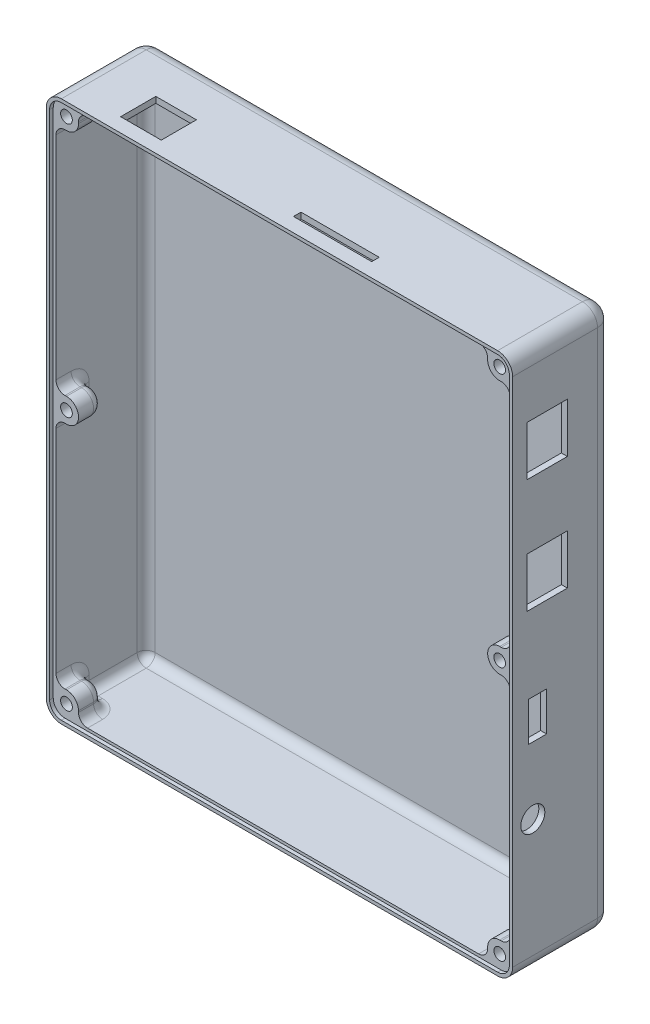
from build123d import *

# Parameters (mm, degrees)
SKETCH1_W           = 155
SKETCH1_H           = 180
BOSS_EXTRUDE1_DEPTH = 32
FILLET2_R           = 5
SHELL1_T            = -2
SKETCH2_R           = 1.95
BOSS_EXTRUDE2_DEPTH = 6
BOSS_EXTRUDE3_DEPTH = 2
FILLET1_R           = 3
BOSS_EXTRUDE4_START = 1.2
BOSS_EXTRUDE4_DEPTH = 1.2
SKETCH4_W           = 13.5
SKETCH4_H           = 11.7
CUT_EXTRUDE1_DEPTH  = 2
SKETCH5_W           = 26
SKETCH5_H           = 2.5
CUT_EXTRUDE2_DEPTH  = 2
SKETCH6_W           = 13.5
SKETCH6_H           = 16.5
CUT_EXTRUDE3_DEPTH  = 2
SKETCH7_W           = 6.1
SKETCH7_H           = 13
CUT_EXTRUDE4_DEPTH  = 2
SKETCH8_R           = 4
CUT_EXTRUDE5_DEPTH  = 2


with BuildPart() as part:
    # Sketch1 → Boss-Extrude1 (new body)
    with BuildSketch(Plane.XY):
        Rectangle(SKETCH1_W, SKETCH1_H)
    extrude(amount=BOSS_EXTRUDE1_DEPTH)

    # Fillet2
    fillet2_edges = [part.edges().sort_by_distance(p)[0] for p in [
        (0, -90, 0),
        (-77.5, 0, 0),
        (0, 90, 0),
        (77.5, 0, 0),
        (77.5, -90, 16),
        (-77.5, -90, 16),
        (-77.5, 90, 16),
        (77.5, 90, 16),
    ]]
    fillet(fillet2_edges, radius=FILLET2_R)

    # Shell1
    shell1_openings = [part.faces().sort_by_distance(p)[0] for p in [
        (0, 0, 32),
    ]]
    offset(amount=SHELL1_T, openings=shell1_openings, kind=Kind.INTERSECTION)

    # Sketch2 → Boss-Extrude2 (add)
    # profile 1 of 6: a face of its own
    with BuildSketch(Plane.XY.offset(32)):
        with BuildLine():
            Line((-72, 4), (-75.5, 4))
            Line((-75.5, 4), (-75.5, -4))
            Line((-75.5, -4), (-72, -4))
            ThreePointArc((-72, -4), (-68, 0), (-72, 4))
        make_face()
        with Locations((-72, 0)):
            Circle(SKETCH2_R, mode=Mode.SUBTRACT)
    # profile 2 of 6: a face of its own
    with BuildSketch(Plane.XY.offset(32)):
        with BuildLine():
            Line((-72.5, -88), (-68, -88))
            Line((-68, -88), (-68, -84.5))
            ThreePointArc((-68, -84.5), (-69.171572875, -81.671572875), (-72, -80.5))
            Line((-72, -80.5), (-75.5, -80.5))
            Line((-75.5, -80.5), (-75.5, -85))
            ThreePointArc((-75.5, -85), (-74.621320344, -87.121320344), (-72.5, -88))
        make_face()
        with Locations((-72, -84.5)):
            Circle(SKETCH2_R, mode=Mode.SUBTRACT)
    # profile 3 of 6: a face of its own
    with BuildSketch(Plane.XY.offset(32)):
        with BuildLine():
            Line((75.5, -85), (75.5, -80.5))
            Line((75.5, -80.5), (72, -80.5))
            ThreePointArc((72, -80.5), (69.171572875, -81.671572875), (68, -84.5))
            Line((68, -84.5), (68, -88))
            Line((68, -88), (72.5, -88))
            ThreePointArc((72.5, -88), (74.621320344, -87.121320344), (75.5, -85))
        make_face()
        with Locations((72, -84.5)):
            Circle(SKETCH2_R, mode=Mode.SUBTRACT)
    # profile 4 of 6: a face of its own
    with BuildSketch(Plane.XY.offset(32)):
        with BuildLine():
            Line((75.5, -4), (75.5, 4))
            Line((75.5, 4), (72, 4))
            ThreePointArc((72, 4), (68, 0), (72, -4))
            Line((72, -4), (75.5, -4))
        make_face()
        with Locations((72, 0)):
            Circle(SKETCH2_R, mode=Mode.SUBTRACT)
    # profile 5 of 6: a face of its own
    with BuildSketch(Plane.XY.offset(32)):
        with BuildLine():
            ThreePointArc((68, 84.5), (69.171572875, 81.671572875), (72, 80.5))
            Line((72, 80.5), (75.5, 80.5))
            Line((75.5, 80.5), (75.5, 85))
            ThreePointArc((75.5, 85), (74.621320344, 87.121320344), (72.5, 88))
            Line((72.5, 88), (68, 88))
            Line((68, 88), (68, 84.5))
        make_face()
        with Locations((72, 84.5)):
            Circle(SKETCH2_R, mode=Mode.SUBTRACT)
    # profile 6 of 6: a face of its own
    with BuildSketch(Plane.XY.offset(32)):
        with BuildLine():
            Line((-68, 84.5), (-68, 88))
            Line((-68, 88), (-72.5, 88))
            ThreePointArc((-72.5, 88), (-74.621320344, 87.121320344), (-75.5, 85))
            Line((-75.5, 85), (-75.5, 80.5))
            Line((-75.5, 80.5), (-72, 80.5))
            ThreePointArc((-72, 80.5), (-69.171572875, 81.671572875), (-68, 84.5))
        make_face()
        with Locations((-72, 84.5)):
            Circle(SKETCH2_R, mode=Mode.SUBTRACT)
    extrude(amount=-BOSS_EXTRUDE2_DEPTH)

    # Sketch3 → Boss-Extrude3 (add)
    with BuildSketch(Plane(origin=(0, 0, 26), x_dir=(-1, 0, 0), z_dir=(0, 0, -1))):
        with BuildLine():
            Line((-68, 84.5), (-68, 88))
            Line((-68, 88), (-72.5, 88))
            ThreePointArc((-72.5, 88), (-74.621320344, 87.121320344), (-75.5, 85))
            Line((-75.5, 85), (-75.5, 80.5))
            Line((-75.5, 80.5), (-72, 80.5))
            ThreePointArc((-72, 80.5), (-69.171572875, 81.671572875), (-68, 84.5))
        make_face()
        with BuildLine():
            Line((-72, 4), (-75.5, 4))
            Line((-75.5, 4), (-75.5, -4))
            Line((-75.5, -4), (-72, -4))
            ThreePointArc((-72, -4), (-68, 0), (-72, 4))
        make_face()
        with BuildLine():
            Line((72, 80.5), (75.5, 80.5))
            Line((75.5, 80.5), (75.5, 85))
            ThreePointArc((75.5, 85), (74.621320344, 87.121320344), (72.5, 88))
            Line((72.5, 88), (68, 88))
            Line((68, 88), (68, 84.5))
            ThreePointArc((68, 84.5), (69.171572875, 81.671572875), (72, 80.5))
        make_face()
        with BuildLine():
            Line((72, -4), (75.5, -4))
            Line((75.5, -4), (75.5, 4))
            Line((75.5, 4), (72, 4))
            ThreePointArc((72, 4), (68, 0), (72, -4))
        make_face()
        with BuildLine():
            Line((68, -84.5), (68, -88))
            Line((68, -88), (72.5, -88))
            ThreePointArc((72.5, -88), (74.621320344, -87.121320344), (75.5, -85))
            Line((75.5, -85), (75.5, -80.5))
            Line((75.5, -80.5), (72, -80.5))
            ThreePointArc((72, -80.5), (69.171572875, -81.671572875), (68, -84.5))
        make_face()
        with BuildLine():
            Line((-72, -80.5), (-75.5, -80.5))
            Line((-75.5, -80.5), (-75.5, -85))
            ThreePointArc((-75.5, -85), (-74.621320344, -87.121320344), (-72.5, -88))
            Line((-72.5, -88), (-68, -88))
            Line((-68, -88), (-68, -84.5))
            ThreePointArc((-68, -84.5), (-69.171572875, -81.671572875), (-72, -80.5))
        make_face()
    extrude(amount=BOSS_EXTRUDE3_DEPTH)

    # Fillet1
    fillet1_edges = [part.edges().sort_by_distance(p)[0] for p in [
        (75.5, -80.5, 28),
        (68, -88, 28),
        (75.5, 4, 28),
        (75.5, -4, 28),
        (68, 88, 28),
        (75.5, 80.5, 28),
        (-75.5, 80.5, 28),
        (-68, 88, 28),
        (69.171572875, 81.671572875, 24),
        (68, 86.25, 24),
        (70.25, 88, 24),
        (74.621320344, 87.121320344, 24),
        (75.5, 82.75, 24),
        (73.75, 80.5, 24),
        (68, 0, 24),
        (73.75, 4, 24),
        (75.5, 0, 24),
        (73.75, -4, 24),
        (-69.171572875, -81.671572875, 24),
        (-68, -86.25, 24),
        (-70.25, -88, 24),
        (-74.621320344, -87.121320344, 24),
        (-75.5, -82.75, 24),
        (-73.75, -80.5, 24),
        (-69.171572875, 81.671572875, 24),
        (-73.75, 80.5, 24),
        (-75.5, 82.75, 24),
        (-74.621320344, 87.121320344, 24),
        (-70.25, 88, 24),
        (-68, 86.25, 24),
        (-68, 0, 24),
        (-73.75, -4, 24),
        (-75.5, 0, 24),
        (-73.75, 4, 24),
        (69.171572875, -81.671572875, 24),
        (73.75, -80.5, 24),
        (75.5, -82.75, 24),
        (74.621320344, -87.121320344, 24),
        (70.25, -88, 24),
        (68, -86.25, 24),
        (-75.5, -4, 28),
        (-75.5, 4, 28),
        (-68, -88, 28),
        (-75.5, -80.5, 28),
    ]]
    fillet(fillet1_edges, radius=FILLET1_R)

    # Sketch12 → Boss-Extrude4 (add)
    with BuildSketch(Plane.XY.offset(32).offset(BOSS_EXTRUDE4_START)):
        with BuildLine():
            Line((-77.5, 85), (-77.5, -85))
            ThreePointArc((-77.5, -85), (-76.035533906, -88.535533906), (-72.5, -90))
            Line((-72.5, -90), (72.5, -90))
            ThreePointArc((72.5, -90), (76.035533906, -88.535533906), (77.5, -85))
            Line((77.5, -85), (77.5, 85))
            ThreePointArc((77.5, 85), (76.035533906, 88.535533906), (72.5, 90))
            Line((72.5, 90), (-72.5, 90))
            ThreePointArc((-72.5, 90), (-76.035533906, 88.535533906), (-77.5, 85))
        make_face()
        with BuildLine():
            Line((-76.4, 85), (-76.4, -85))
            ThreePointArc((-76.4, -85), (-75.257716447, -87.757716447), (-72.5, -88.9))
            Line((-72.5, -88.9), (72.5, -88.9))
            ThreePointArc((72.5, -88.9), (75.257716447, -87.757716447), (76.4, -85))
            Line((76.4, -85), (76.4, 85))
            ThreePointArc((76.4, 85), (75.257716447, 87.757716447), (72.5, 88.9))
            Line((72.5, 88.9), (-72.5, 88.9))
            ThreePointArc((-72.5, 88.9), (-75.257716447, 87.757716447), (-76.4, 85))
        make_face(mode=Mode.SUBTRACT)
    extrude(amount=-BOSS_EXTRUDE4_DEPTH)

    # Sketch4 → Cut-Extrude1 (cut)
    with BuildSketch(Plane(origin=(0, 90, 0), x_dir=(1, 0, 0), z_dir=(0, 1, 0))):
        with Locations((-50.75, -22.65)):
            Rectangle(SKETCH4_W, SKETCH4_H)
    extrude(amount=-CUT_EXTRUDE1_DEPTH, mode=Mode.SUBTRACT)

    # Sketch5 → Cut-Extrude2 (cut)
    with BuildSketch(Plane(origin=(0, 90, 0), x_dir=(1, 0, 0), z_dir=(0, 1, 0))):
        with Locations((12.95, -27.25)):
            Rectangle(SKETCH5_W, SKETCH5_H)
    extrude(amount=-CUT_EXTRUDE2_DEPTH, mode=Mode.SUBTRACT)

    # Sketch6 → Cut-Extrude3 (cut)
    with BuildSketch(Plane(origin=(77.5, 0, 0), x_dir=(0, 0, -1), z_dir=(1, 0, 0))):
        with Locations((-21.75, 61.2)):
            Rectangle(SKETCH6_W, SKETCH6_H)
        with Locations((-21.75, 23.3)):
            Rectangle(SKETCH6_W, SKETCH6_H)
    extrude(amount=-CUT_EXTRUDE3_DEPTH, mode=Mode.SUBTRACT)

    # Sketch7 → Cut-Extrude4 (cut)
    with BuildSketch(Plane(origin=(77.5, 0, 0), x_dir=(0, 0, -1), z_dir=(1, 0, 0))):
        with Locations((-24.95, -17)):
            Rectangle(SKETCH7_W, SKETCH7_H)
    extrude(amount=-CUT_EXTRUDE4_DEPTH, mode=Mode.SUBTRACT)

    # Sketch8 → Cut-Extrude5 (cut)
    with BuildSketch(Plane.ZY.offset(-77.5)):
        with Locations((26.5, -45.7)):
            Circle(SKETCH8_R)
    extrude(amount=CUT_EXTRUDE5_DEPTH, mode=Mode.SUBTRACT)


solid = part.part
